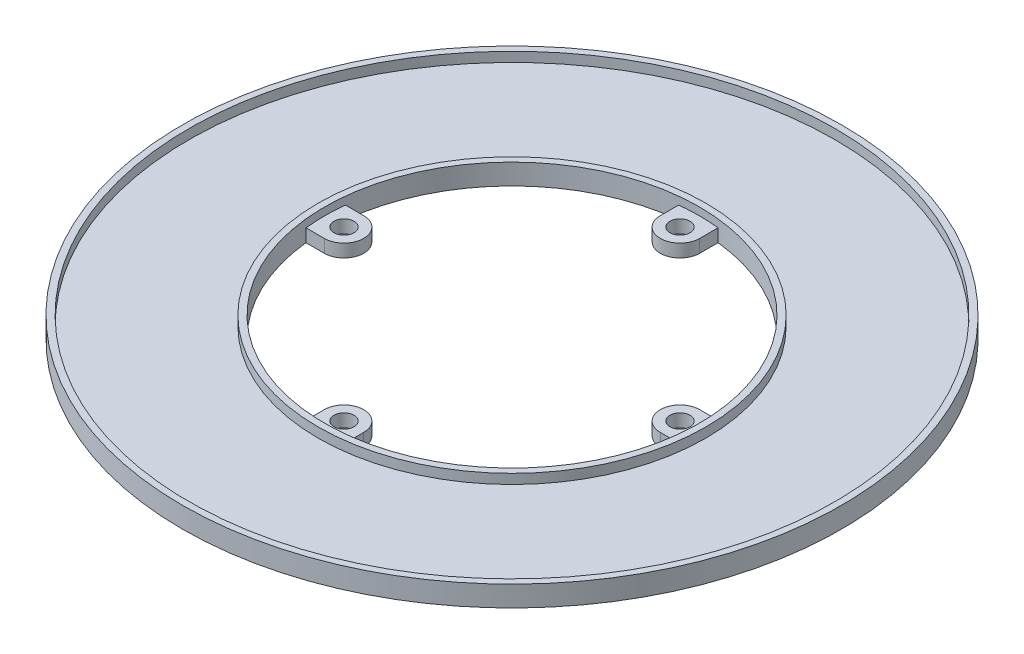
from build123d import *

# Parameters (mm, degrees)
EXTRUDE_START       = -2
EXTRUDE_1_DEPTH     = 2
CUT_EXTRUDE_1_REACH = 74.196
SKETCH_2_4_R        = 1.55


with BuildPart() as part:
    # 草图1 → 旋转1 (revolve)
    with BuildSketch(Plane.XY):
        Polygon((29, 0), (29, 3.2), (30, 3.2), (30, 1.7), (50, 1.7), (50, 3.2), (51, 3.2), (51, 0), align=None)
    revolve(axis=Axis((0, 0, 0), (0, 1, 0)))

    # 草图2 → 凸台-拉伸1 (add)
    with BuildSketch(Plane.XZ.offset(EXTRUDE_START)):
        with BuildLine():
            Line((-3.05, 26), (-3.05, 28.839166077))
            ThreePointArc((-3.05, 28.839166077), (0, 29), (3.05, 28.839166077))
            Line((3.05, 28.839166077), (3.05, 26))
            ThreePointArc((3.05, 26), (0, 22.95), (-3.05, 26))
        make_face()
        with BuildLine():
            Line((26, 3.05), (28.839166077, 3.05))
            ThreePointArc((28.839166077, 3.05), (29, 0), (28.839166077, -3.05))
            Line((28.839166077, -3.05), (26, -3.05))
            ThreePointArc((26, -3.05), (22.95, 0), (26, 3.05))
        make_face()
        with BuildLine():
            Line((3.05, -26), (3.05, -28.839166077))
            ThreePointArc((3.05, -28.839166077), (0, -29), (-3.05, -28.839166077))
            Line((-3.05, -28.839166077), (-3.05, -26))
            ThreePointArc((-3.05, -26), (0, -22.95), (3.05, -26))
        make_face()
        with BuildLine():
            Line((-26, -3.05), (-28.839166077, -3.05))
            ThreePointArc((-28.839166077, -3.05), (-29, 0), (-28.839166077, 3.05))
            Line((-28.839166077, 3.05), (-26, 3.05))
            ThreePointArc((-26, 3.05), (-22.95, 0), (-26, -3.05))
        make_face()
    extrude(amount=EXTRUDE_1_DEPTH)

    # 草图2<4> → 切除-拉伸1 (cut, up to next)
    with BuildSketch(Plane.XZ, mode=Mode.PRIVATE) as cut_extrude_1_sk1:
        with Locations((0, 26)):
            Circle(SKETCH_2_4_R)
    cut_extrude_1_tool1 = extrude(cut_extrude_1_sk1.sketch, amount=-CUT_EXTRUDE_1_REACH, mode=Mode.PRIVATE) & part.part
    # 草图2<4> → 切除-拉伸1 (cut, up to next)
    with BuildSketch(Plane.XZ, mode=Mode.PRIVATE) as cut_extrude_1_sk2:
        with Locations((26, 0)):
            Circle(SKETCH_2_4_R)
    cut_extrude_1_tool2 = extrude(cut_extrude_1_sk2.sketch, amount=-CUT_EXTRUDE_1_REACH, mode=Mode.PRIVATE) & part.part
    # 草图2<4> → 切除-拉伸1 (cut, up to next)
    with BuildSketch(Plane.XZ, mode=Mode.PRIVATE) as cut_extrude_1_sk3:
        with Locations((0, -26)):
            Circle(SKETCH_2_4_R)
    cut_extrude_1_tool3 = extrude(cut_extrude_1_sk3.sketch, amount=-CUT_EXTRUDE_1_REACH, mode=Mode.PRIVATE) & part.part
    # 草图2<4> → 切除-拉伸1 (cut, up to next)
    with BuildSketch(Plane.XZ, mode=Mode.PRIVATE) as cut_extrude_1_sk4:
        with Locations((-26, 0)):
            Circle(SKETCH_2_4_R)
    cut_extrude_1_tool4 = extrude(cut_extrude_1_sk4.sketch, amount=-CUT_EXTRUDE_1_REACH, mode=Mode.PRIVATE) & part.part
    add(cut_extrude_1_tool1.solids().sort_by_distance((0, 0, 26))[0], mode=Mode.SUBTRACT)
    add(cut_extrude_1_tool2.solids().sort_by_distance((26, 0, 0))[0], mode=Mode.SUBTRACT)
    add(cut_extrude_1_tool3.solids().sort_by_distance((0, 0, -26))[0], mode=Mode.SUBTRACT)
    add(cut_extrude_1_tool4.solids().sort_by_distance((-26, 0, 0))[0], mode=Mode.SUBTRACT)


solid = part.part
